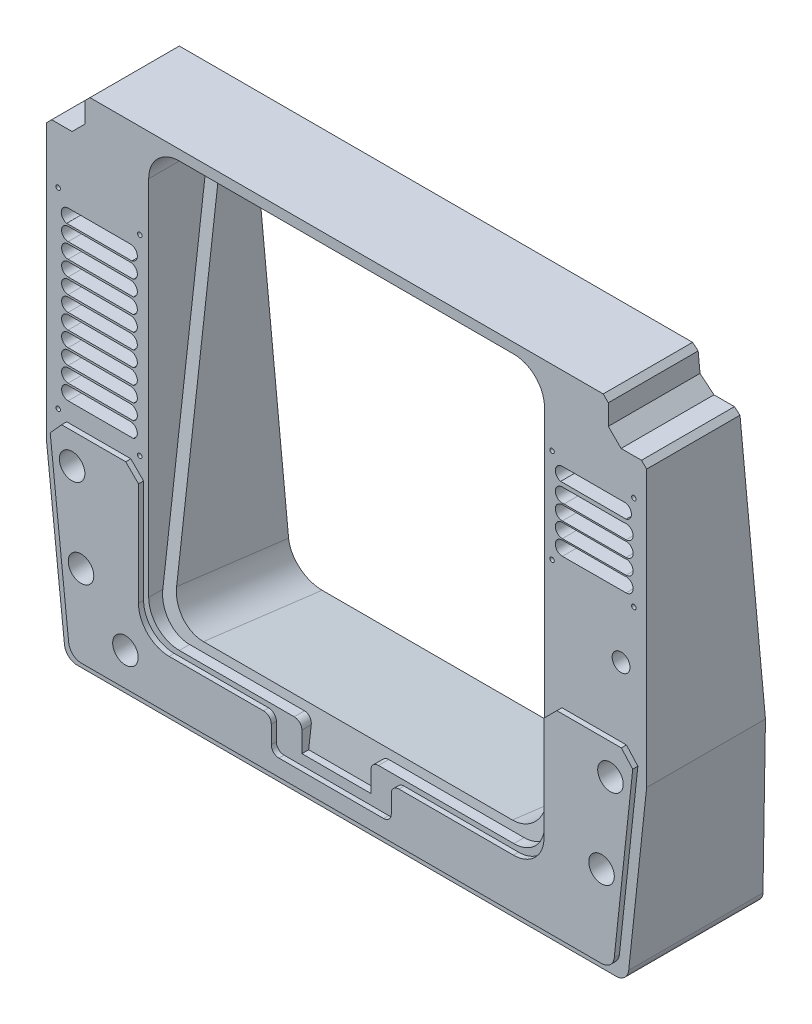
from build123d import *

# Parameters (mm, degrees)
BOSS_EXTRUDE1_DEPTH      = 53
CUT_EXTRUDE1_DEPTH       = 53
BOSS_EXTRUDE2_DEPTH      = 173
CUT_EXTRUDE2_DEPTH       = 53
CUT_EXTRUDE3_REACH       = 217.944
SKETCH6_W                = 27
SKETCH6_H                = 11
FILLET1_R                = 3
FILLET2_R                = 5
BOSS_EXTRUDE3_DEPTH      = 2
CUT_EXTRUDE5_START       = -53
SKETCH15_R               = 0.875
CUT_EXTRUDE5_DEPTH       = 15
SKETCH16_R               = 5
SKETCH16_R_2             = 3.5
CUT_EXTRUDE6_DEPTH       = 60
CUT_EXTRUDE7_DEPTH       = 53
CUT_EXTRUDE10_DEPTH      = 266.430234434
CUT_EXTRUDE10_DEPTH_BACK = 266.430234434


with BuildPart() as part:
    # Sketch1 → Boss-Extrude1 (new body)
    with BuildSketch(Plane.XY):
        Polygon((177.819161681, -40.46813727), (170.319161681, -110.46813727), (-49.680838319, -110.46813727), (-57.180838319, -40.46813727), (-57.180838319, 67.53186273), (-55.180838319, 69.53186273), (-47.180838319, 69.53186273), (-42.180838319, 74.53186273), (-42.180838319, 82.53186273), (-40.180838319, 84.53186273), (160.819161681, 84.53186273), (162.819161681, 82.53186273), (162.819161681, 74.53186273), (167.819161681, 69.53186273), (175.819161681, 69.53186273), (177.819161681, 67.53186273), align=None)
    extrude(amount=BOSS_EXTRUDE1_DEPTH)

    # Sketch2 → Cut-Extrude1 (cut)
    with BuildSketch(Plane.XY.offset(53)):
        with BuildLine():
            Line((-5.180838319, 80.53186273), (125.819161681, 80.53186273))
            ThreePointArc((125.819161681, 80.53186273), (134.304443055, 77.017144104), (137.819161681, 68.53186273))
            Line((137.819161681, 68.53186273), (137.819161681, -73.46813727))
            ThreePointArc((137.819161681, -73.46813727), (134.304443055, -81.953418644), (125.819161681, -85.46813727))
            Line((125.819161681, -85.46813727), (-5.180838319, -85.46813727))
            ThreePointArc((-5.180838319, -85.46813727), (-13.666119693, -81.953418644), (-17.180838319, -73.46813727))
            Line((-17.180838319, -73.46813727), (-17.180838319, 68.53186273))
            ThreePointArc((-17.180838319, 68.53186273), (-13.666119693, 77.017144104), (-5.180838319, 80.53186273))
        make_face()
    extrude(amount=-CUT_EXTRUDE1_DEPTH, mode=Mode.SUBTRACT)

    # Sketch3 → Boss-Extrude2 (add)
    with BuildSketch(Plane(origin=(-17.180838319, 0, 0), x_dir=(0, 0, -1), z_dir=(1, 0, 0))):
        Polygon((-50.953884791, -101.313223072), (-28, 81.899781139), (0, 81.899781139), (0, -101.313223072), align=None)
    extrude(amount=BOSS_EXTRUDE2_DEPTH)

    # Sketch4 → Cut-Extrude2 (cut)
    with BuildSketch(Plane(origin=(0, 4.719439462, 37.669557457), x_dir=(1, 0, 0), z_dir=(0, 0.12431340062476821, 0.9922430037168848))):
        with BuildLine():
            Line((-0.180838319, 70.405097324), (120.819161681, 70.405097324))
            ThreePointArc((120.819161681, 70.405097324), (129.304443055, 66.890378698), (132.819161681, 58.405097324))
            Line((132.819161681, 58.405097324), (132.819161681, -75.594902676))
            ThreePointArc((132.819161681, -75.594902676), (129.304443055, -84.08018405), (120.819161681, -87.594902676))
            Line((120.819161681, -87.594902676), (-0.180838319, -87.594902676))
            ThreePointArc((-0.180838319, -87.594902676), (-8.666119693, -84.08018405), (-12.180838319, -75.594902676))
            Line((-12.180838319, -75.594902676), (-12.180838319, 58.405097324))
            ThreePointArc((-12.180838319, 58.405097324), (-8.666119693, 66.890378698), (-0.180838319, 70.405097324))
        make_face()
    extrude(amount=-CUT_EXTRUDE2_DEPTH, mode=Mode.SUBTRACT)

    # Cut-Extrude3: up to this plane
    cut_extrude3_end = Plane(origin=(155.819161681, -101.313223072, 50.953884791), z_dir=(0, -0.12431340062476823, -0.9922430037168848))
    # Sketch6 → Cut-Extrude3 (cut, up to the surface)
    with BuildSketch(Plane.XY.offset(53), mode=Mode.PRIVATE) as cut_extrude3_sk1:
        with Locations((56.319161681, -90.96813727)):
            Rectangle(SKETCH6_W, SKETCH6_H)
    cut_extrude3_tool1 = split(extrude(cut_extrude3_sk1.sketch, amount=-CUT_EXTRUDE3_REACH, mode=Mode.PRIVATE), bisect_by=cut_extrude3_end, keep=Keep.BOTH, mode=Mode.PRIVATE)
    add(cut_extrude3_tool1.solids().sort_by_distance((56.319162, -90.968137, 53))[0], mode=Mode.SUBTRACT)

    # Fillet1
    fillet1_edges = [part.edges().sort_by_distance(p)[0] for p in [
        (69.819161681, -85.46813727, 50.984364725),
        (42.819161681, -85.46813727, 50.984364725),
    ]]
    fillet(fillet1_edges, radius=FILLET1_R)

    # Fillet2
    fillet2_edges = [part.edges().sort_by_distance(p)[0] for p in [
        (170.319161681, -110.46813727, 26.5),
        (-49.680838319, -110.46813727, 26.5),
    ]]
    fillet(fillet2_edges, radius=FILLET2_R)

    # Sketch7 → Boss-Extrude3 (add)
    with BuildSketch(Plane.XY.offset(53)):
        with BuildLine():
            Line((-53.750279032, -34.93968304), (-46.51158762, -102.500802888))
            ThreePointArc((-46.51158762, -102.500802888), (-44.881947887, -105.687231789), (-41.54004185, -106.96813727))
            Line((-41.54004185, -106.96813727), (162.178365212, -106.96813727))
            ThreePointArc((162.178365212, -106.96813727), (165.520271248, -105.687231789), (167.149910982, -102.500802888))
            Line((167.149910982, -102.500802888), (174.388602394, -34.93968304))
            Line((174.388602394, -34.93968304), (169.921268012, -29.96813727))
            Line((169.921268012, -29.96813727), (144.661268012, -29.96813727))
            Line((144.661268012, -29.96813727), (139.661268012, -34.96813727))
            Line((139.661268012, -34.96813727), (139.661268012, -75.46813727))
            ThreePointArc((139.661268012, -75.46813727), (136.146549386, -83.953418644), (127.661268012, -87.46813727))
            Line((127.661268012, -87.46813727), (82.819161681, -87.46813727))
            ThreePointArc((82.819161681, -87.46813727), (80.697841337, -88.346816926), (79.819161681, -90.46813727))
            Line((79.819161681, -90.46813727), (79.819161681, -97.46813727))
            ThreePointArc((79.819161681, -97.46813727), (78.940482024, -99.589457613), (76.819161681, -100.46813727))
            Line((76.819161681, -100.46813727), (35.819161681, -100.46813727))
            ThreePointArc((35.819161681, -100.46813727), (33.697841337, -99.589457613), (32.819161681, -97.46813727))
            Line((32.819161681, -97.46813727), (32.819161681, -90.46813727))
            ThreePointArc((32.819161681, -90.46813727), (31.940482024, -88.346816926), (29.819161681, -87.46813727))
            Line((29.819161681, -87.46813727), (-7.180838319, -87.46813727))
            ThreePointArc((-7.180838319, -87.46813727), (-15.666119693, -83.953418644), (-19.180838319, -75.46813727))
            Line((-19.180838319, -75.46813727), (-19.180838319, -34.96813727))
            Line((-19.180838319, -34.96813727), (-24.180838319, -29.96813727))
            Line((-24.180838319, -29.96813727), (-49.282944651, -29.96813727))
            Line((-49.282944651, -29.96813727), (-53.750279032, -34.93968304))
        make_face()
    extrude(amount=BOSS_EXTRUDE3_DEPTH)

    # Sketch15 → Cut-Extrude5 (cut)
    with BuildSketch(Plane(origin=(0, 0, 0), x_dir=(-1, 0, 0), z_dir=(0, 0, -1)).offset(CUT_EXTRUDE5_START)):
        with Locations((20.660936544, 47.788050152)):
            Circle(SKETCH15_R)
        with Locations((52.632941059, 47.788050152)):
            Circle(SKETCH15_R)
        with Locations((20.66034531, -27.2169858)):
            Circle(SKETCH15_R)
        with Locations((52.641661171, -27.2169858)):
            Circle(SKETCH15_R)
        with Locations((-172.818617646, 55.216027955)):
            Circle(SKETCH15_R)
        with Locations((-140.781598512, 55.216027955)):
            Circle(SKETCH15_R)
        with Locations((-140.781598512, 18.276964475)):
            Circle(SKETCH15_R)
        with Locations((-172.818617646, 18.276964475)):
            Circle(SKETCH15_R)
    extrude(amount=CUT_EXTRUDE5_DEPTH, mode=Mode.SUBTRACT)

    # Sketch16 → Cut-Extrude6 (cut)
    with BuildSketch(Plane.XY.offset(55)):
        with Locations((162.161268012, -74.96813727)):
            Circle(SKETCH16_R)
        with Locations((165.661268012, -41.96813727)):
            Circle(SKETCH16_R)
        with Locations((-24.294163199, -93.96813727)):
            Circle(SKETCH16_R)
        with Locations((-41.680838319, -74.96813727)):
            Circle(SKETCH16_R)
        with Locations((-45.180838319, -41.96813727)):
            Circle(SKETCH16_R)
        with Locations(Location((167.819161681, -2.96813727, 0), (0, 0, 180))):
            Circle(SKETCH16_R_2)
    extrude(amount=-CUT_EXTRUDE6_DEPTH, mode=Mode.SUBTRACT)

    # Sketch17 → Cut-Extrude7 (cut)
    with BuildSketch(Plane.XY.offset(53)):
        with BuildLine():
            ThreePointArc((-48.680838319, 12.640610294), (-51.289466711, 10.056798037), (-48.730706654, 7.423591846))
            Line((-48.730706654, 7.423591846), (-23.158864594, 7.423591846))
            ThreePointArc((-23.158864594, 7.423591846), (-21.695583243, 10.514388815), (-24.373903693, 12.640610294))
            Line((-24.373903693, 12.640610294), (-48.680838319, 12.640610294))
        make_face()
        with BuildLine():
            Line((-24.373903693, 36.640610294), (-48.680838319, 36.640610294))
            ThreePointArc((-48.680838319, 36.640610294), (-51.289466711, 34.056798037), (-48.730706654, 31.423591846))
            Line((-48.730706654, 31.423591846), (-23.158864594, 31.423591846))
            ThreePointArc((-23.158864594, 31.423591846), (-21.695583243, 34.514388815), (-24.373903693, 36.640610294))
        make_face()
        with BuildLine():
            Line((-24.370838319, 42.78186273), (-48.680838319, 42.78186273))
            ThreePointArc((-48.680838319, 42.78186273), (-51.413721309, 40.338213126), (-49.289725436, 37.350117686))
            Line((-49.289725436, 37.350117686), (-23.761951202, 37.350117686))
            ThreePointArc((-23.761951202, 37.350117686), (-21.63795533, 40.338213126), (-24.370838319, 42.78186273))
        make_face()
        with BuildLine():
            Line((-24.373903693, 30.640610294), (-48.680838319, 30.640610294))
            ThreePointArc((-48.680838319, 30.640610294), (-51.289466711, 28.056798037), (-48.730706654, 25.423591846))
            Line((-48.730706654, 25.423591846), (-23.158864594, 25.423591846))
            ThreePointArc((-23.158864594, 25.423591846), (-21.695583243, 28.514388815), (-24.373903693, 30.640610294))
        make_face()
        with BuildLine():
            Line((-24.373903693, 24.640610294), (-48.680838319, 24.640610294))
            ThreePointArc((-48.680838319, 24.640610294), (-51.289466711, 22.056798037), (-48.730706654, 19.423591846))
            Line((-48.730706654, 19.423591846), (-23.158864594, 19.423591846))
            ThreePointArc((-23.158864594, 19.423591846), (-21.695583243, 22.514388815), (-24.373903693, 24.640610294))
        make_face()
        with BuildLine():
            Line((-24.373903693, 18.640610294), (-48.680838319, 18.640610294))
            ThreePointArc((-48.680838319, 18.640610294), (-51.289466711, 16.056798037), (-48.730706654, 13.423591846))
            Line((-48.730706654, 13.423591846), (-23.158864594, 13.423591846))
            ThreePointArc((-23.158864594, 13.423591846), (-21.695583243, 16.514388815), (-24.373903693, 18.640610294))
        make_face()
        with BuildLine():
            Line((-24.373903693, 6.640610294), (-48.680838319, 6.640610294))
            ThreePointArc((-48.680838319, 6.640610294), (-51.289466711, 4.056798037), (-48.730706654, 1.423591846))
            Line((-48.730706654, 1.423591846), (-23.158864594, 1.423591846))
            ThreePointArc((-23.158864594, 1.423591846), (-21.695583243, 4.514388815), (-24.373903693, 6.640610294))
        make_face()
        with BuildLine():
            Line((-24.373903693, 0.640610294), (-48.680838319, 0.640610294))
            ThreePointArc((-48.680838319, 0.640610294), (-51.289466711, -1.943201963), (-48.730706654, -4.576408154))
            Line((-48.730706654, -4.576408154), (-23.158864594, -4.576408154))
            ThreePointArc((-23.158864594, -4.576408154), (-21.695583243, -1.485611185), (-24.373903693, 0.640610294))
        make_face()
        with BuildLine():
            Line((-24.373903693, -5.359389706), (-48.680838319, -5.359389706))
            ThreePointArc((-48.680838319, -5.359389706), (-51.289466711, -7.943201963), (-48.730706654, -10.576408154))
            Line((-48.730706654, -10.576408154), (-23.158864594, -10.576408154))
            ThreePointArc((-23.158864594, -10.576408154), (-21.695583243, -7.485611185), (-24.373903693, -5.359389706))
        make_face()
        with BuildLine():
            Line((-24.373903693, -11.359389706), (-48.680838319, -11.359389706))
            ThreePointArc((-48.680838319, -11.359389706), (-51.289466711, -13.943201963), (-48.730706654, -16.576408154))
            Line((-48.730706654, -16.576408154), (-23.158864594, -16.576408154))
            ThreePointArc((-23.158864594, -16.576408154), (-21.695583243, -13.485611185), (-24.373903693, -11.359389706))
        make_face()
        with BuildLine():
            Line((-24.376767271, -17.359389706), (-48.683701898, -17.359389706))
            ThreePointArc((-48.683701898, -17.359389706), (-51.292330289, -19.943201963), (-48.733570233, -22.576408154))
            Line((-48.733570233, -22.576408154), (-23.161728173, -22.576408154))
            ThreePointArc((-23.161728173, -22.576408154), (-21.698446821, -19.485611185), (-24.376767271, -17.359389706))
        make_face()
        with BuildLine():
            ThreePointArc((144.793170183, 44.961739899), (142.090877129, 41.866952011), (145.478331588, 39.542032205))
            Line((145.478331588, 39.542032205), (169.785266214, 39.542032205))
            ThreePointArc((169.785266214, 39.542032205), (172.515119338, 42.62430005), (169.125599003, 44.961739899))
            Line((169.125599003, 44.961739899), (144.793170183, 44.961739899))
        make_face()
        with BuildLine():
            Line((169.126096307, 51.96186273), (144.819161681, 51.96186273))
            ThreePointArc((144.819161681, 51.96186273), (142.090110058, 49.550650632), (144.146747373, 46.545337088))
            Line((144.146747373, 46.545337088), (169.798510615, 46.545337088))
            ThreePointArc((169.798510615, 46.545337088), (171.85514793, 49.550650632), (169.126096307, 51.96186273))
        make_face()
        with BuildLine():
            ThreePointArc((169.785266214, 33.542032205), (172.515119338, 36.62430005), (169.125599003, 38.961739899))
            Line((169.125599003, 38.961739899), (144.793170183, 38.961739899))
            ThreePointArc((144.793170183, 38.961739899), (142.069192389, 36.198866836), (144.819161681, 33.46186273))
            Line((144.819161681, 33.46186273), (169.785266214, 33.542032205))
        make_face()
        with BuildLine():
            ThreePointArc((169.785266214, 27.542032205), (172.515119338, 30.62430005), (169.125599003, 32.961739899))
            Line((169.125599003, 32.961739899), (144.793170183, 32.961739899))
            ThreePointArc((144.793170183, 32.961739899), (142.069192389, 30.198866836), (144.819161681, 27.46186273))
            Line((144.819161681, 27.46186273), (169.785266214, 27.542032205))
        make_face()
        with BuildLine():
            ThreePointArc((169.794095223, 21.542046378), (172.514582439, 24.628681791), (169.125599003, 26.961739899))
            Line((169.125599003, 26.961739899), (144.793170183, 26.961739899))
            ThreePointArc((144.793170183, 26.961739899), (142.069192389, 24.198866836), (144.819161681, 21.46186273))
            Line((144.819161681, 21.46186273), (169.794095223, 21.542046378))
        make_face()
    extrude(amount=-CUT_EXTRUDE7_DEPTH, mode=Mode.SUBTRACT)

    # Sketch18 → Cut-Extrude10 (cut, two sides: drawn at the far end of the back side and taken through both)
    with BuildSketch(Plane.ZY.offset(57.180838319).offset(-CUT_EXTRUDE10_DEPTH_BACK)):
        Polygon((56.165376851, 497.990111947), (18, 84.53186273), (0, -110.46813727), (-38.165376851, -523.926386487), (-865.081875285, -447.595632785), (-770.751121583, 574.320865649), align=None)
    extrude(amount=CUT_EXTRUDE10_DEPTH + CUT_EXTRUDE10_DEPTH_BACK, mode=Mode.SUBTRACT)


solid = part.part
